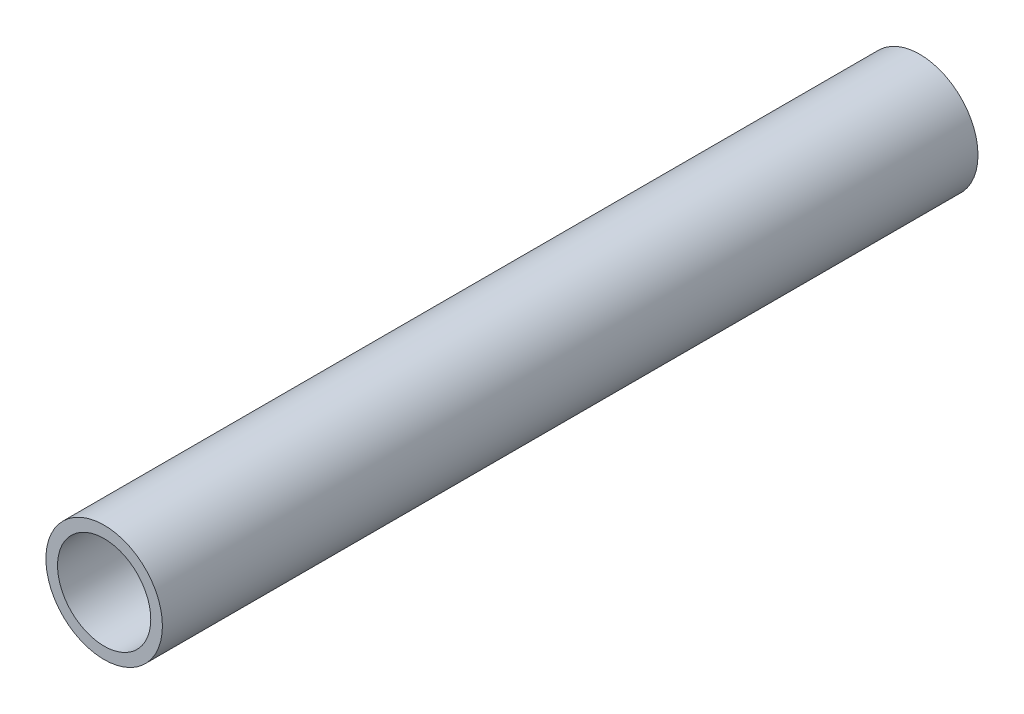
from build123d import *

# Parameters (mm, degrees)
SKETCH1_R           = 12.5
SKETCH1_R_2         = 10
BOSS_EXTRUDE1_DEPTH = 87.5


with BuildPart() as part:
    # Sketch1 → Boss-Extrude1 (new, symmetric)
    with BuildSketch(Plane.XY):
        Circle(SKETCH1_R)
        Circle(SKETCH1_R_2, mode=Mode.SUBTRACT)
    extrude(amount=BOSS_EXTRUDE1_DEPTH, both=True)


solid = part.part
